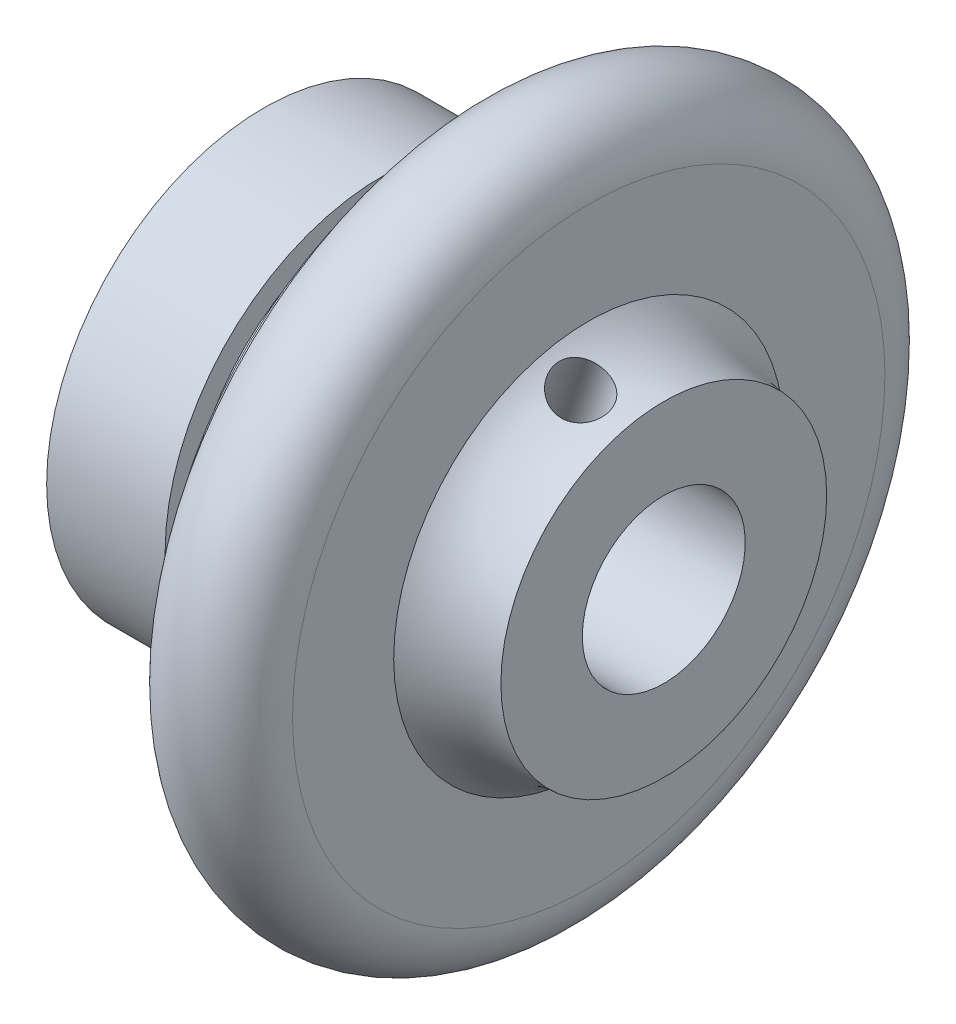
from build123d import *

# Parameters (mm, degrees)
F_3_5_3_5_DIAMETER_HOLE1_D     = 3.5
F_3_5_3_5_DIAMETER_HOLE1_DEPTH = 12
F_3_5_3_5_DIAMETER_HOLE1_TIP   = 1.75


with BuildPart() as part:
    # Sketch2 → Revolve1 (revolve)
    with BuildSketch(Plane.XY, mode=Mode.PRIVATE) as revolve1_sk:
        with BuildLine():
            Line((0, 5.5), (27, 5.5))
            Line((27, 5.5), (27, 11))
            ThreePointArc((27, 11), (24.244097244, 11.565328291), (21.93333443, 13.17))
            Line((21.93333443, 13.17), (21.93333443, 20))
            ThreePointArc((21.93333443, 20), (17.93333443, 24), (13.93333443, 20))
            Line((13.93333443, 20), (12.93333443, 20))
            Line((12.93333443, 20), (12.93333443, 13.17))
            Line((12.93333443, 13.17), (8, 13.17))
            Line((8, 13.17), (8, 14.67))
            Line((8, 14.67), (0, 14.67))
            Line((0, 14.67), (0, 5.5))
        make_face()
    revolve(revolve1_sk.sketch.rotate(Axis((0, 0, 0), (1, 0, 0)), 90), axis=Axis((0, 0, 0), (1, 0, 0)))

    # Ø3.5 (3.5) Diameter Hole1
    with Locations(Plane(origin=(23.970221342, 11.398844084, 2.591218084), x_dir=(0.897145620837, -0.441734914867, 0), z_dir=(0.432825522508, 0.879051007823, 0.19982840817))):
        with Locations((0, 0)):
            Hole(F_3_5_3_5_DIAMETER_HOLE1_D / 2, depth=F_3_5_3_5_DIAMETER_HOLE1_DEPTH)
            with Locations((0, 0, -(F_3_5_3_5_DIAMETER_HOLE1_DEPTH + F_3_5_3_5_DIAMETER_HOLE1_TIP / 2))):  # 90° drill point
                Cone(0, F_3_5_3_5_DIAMETER_HOLE1_D / 2, F_3_5_3_5_DIAMETER_HOLE1_TIP, mode=Mode.SUBTRACT)


solid = part.part
